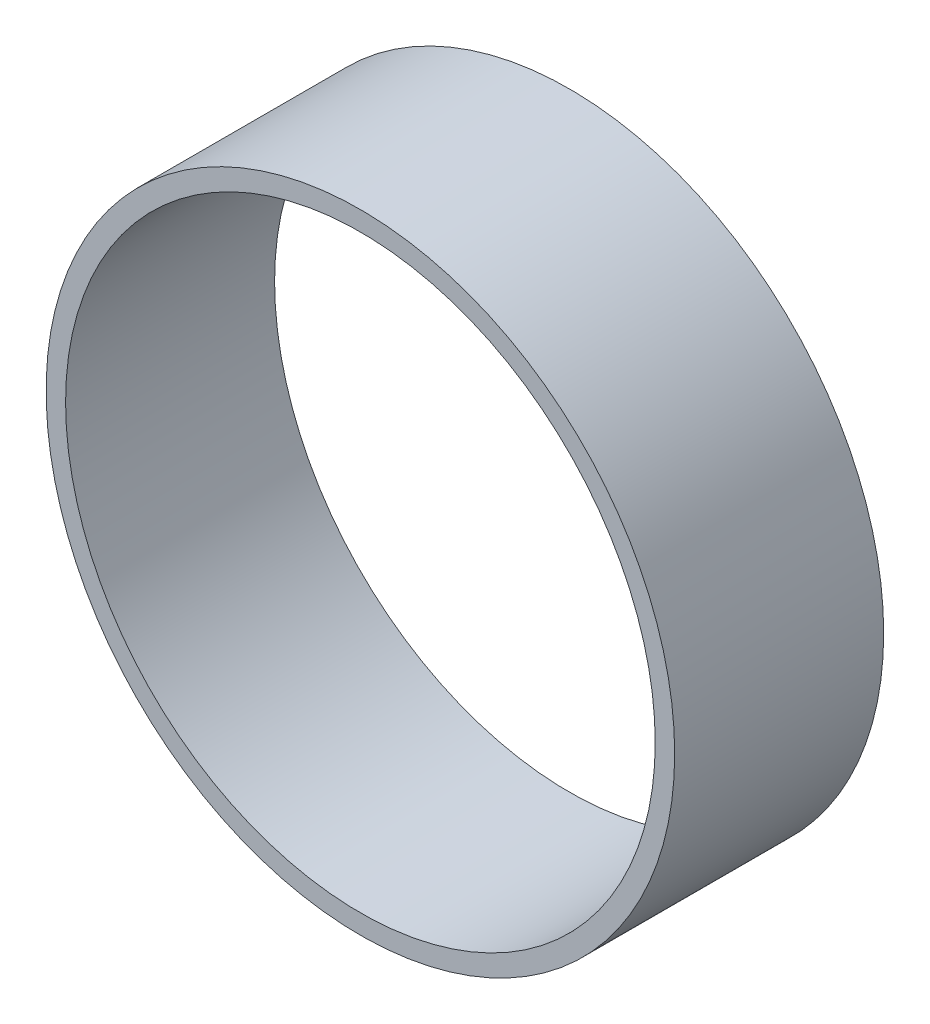
from build123d import *

# Parameters (mm, degrees)
SKETCH_1_R      = 16.15
SKETCH_1_R_2    = 15.15
EXTRUDE_1_DEPTH = 10.74


with BuildPart() as part:
    # 草图1 → 拉伸-薄壁1 (new body)
    with BuildSketch(Plane.XY):
        Circle(SKETCH_1_R)
        Circle(SKETCH_1_R_2, mode=Mode.SUBTRACT)
    extrude(amount=EXTRUDE_1_DEPTH)


solid = part.part
